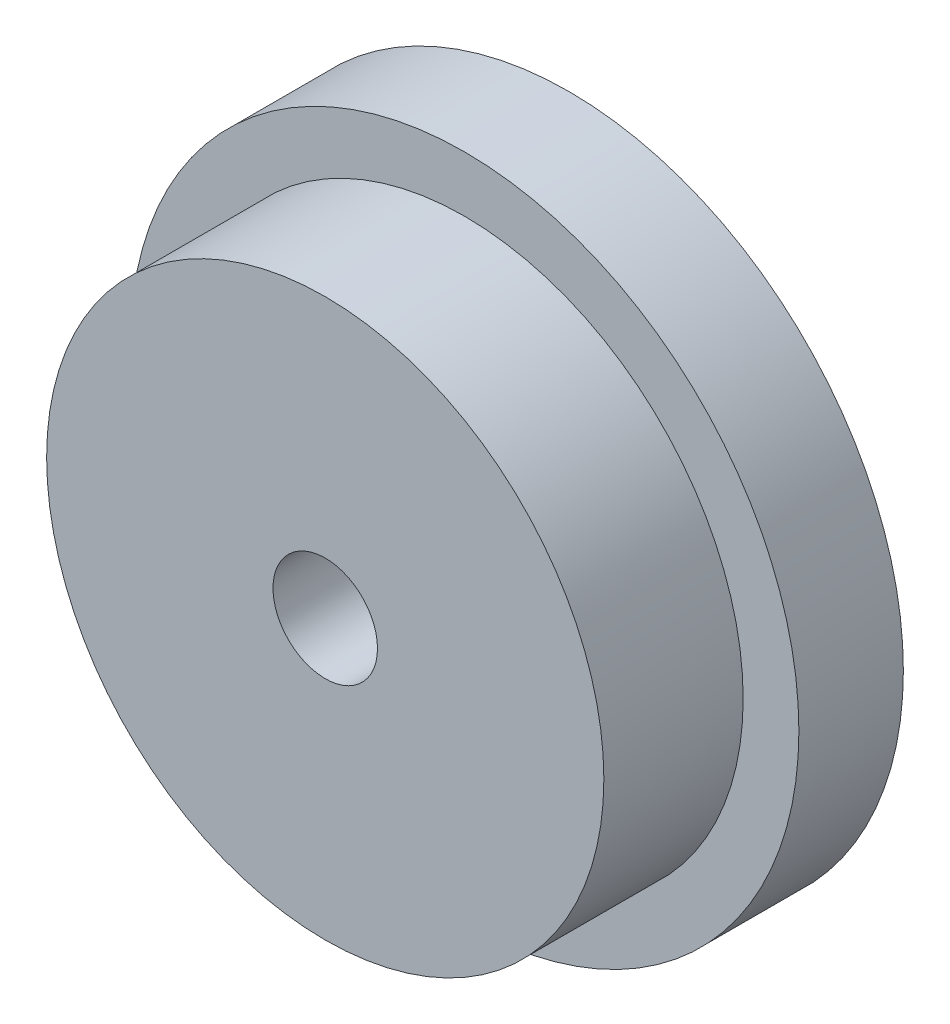
from build123d import *

# Parameters (mm, degrees)
SKETCH1_R           = 30.48
BOSS_EXTRUDE1_DEPTH = 9.525
SKETCH2_R           = 25.4
BOSS_EXTRUDE2_DEPTH = 12.7
SKETCH3_R           = 4.7625
CUT_EXTRUDE1_DEPTH  = 49.497540402


with BuildPart() as part:
    # Sketch1 → Boss-Extrude1 (new body)
    with BuildSketch(Plane.XY):
        with Locations(Location((0, 0, 0), (0, 0, 180))):
            Circle(SKETCH1_R)
    extrude(amount=BOSS_EXTRUDE1_DEPTH)

    # Sketch2 → Boss-Extrude2 (add)
    with BuildSketch(Plane.XY.offset(9.525)):
        Circle(SKETCH2_R)
    extrude(amount=BOSS_EXTRUDE2_DEPTH)

    # Sketch3 → Cut-Extrude1 (cut, through all)
    with BuildSketch(Plane.XY.offset(22.225)):
        Circle(SKETCH3_R)
    extrude(amount=-CUT_EXTRUDE1_DEPTH, mode=Mode.SUBTRACT)


solid = part.part
